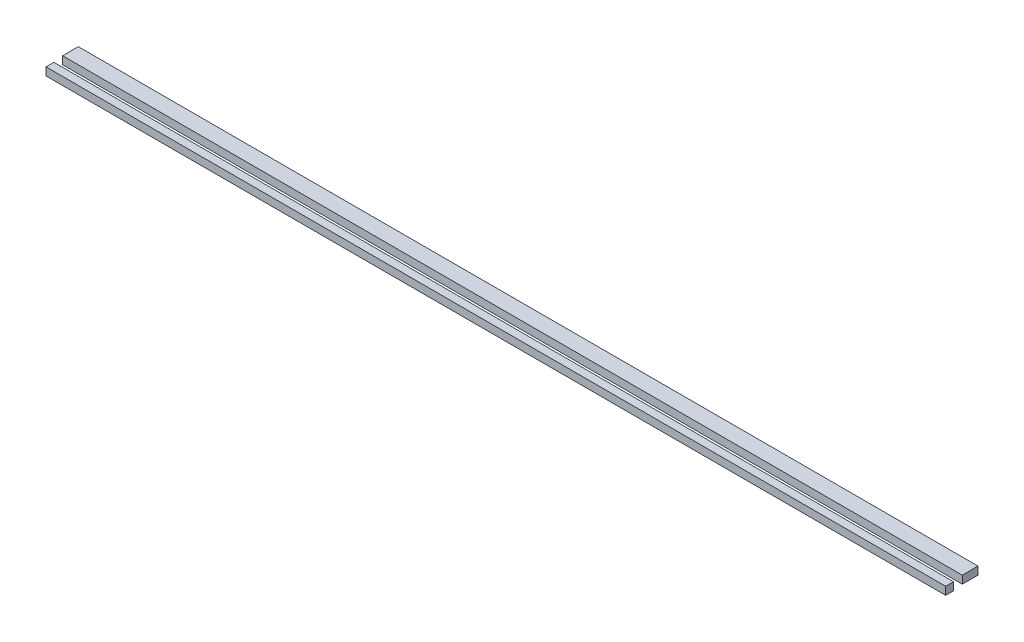
from build123d import *

# Parameters (mm, degrees)
SKETCH1_W           = 343
SKETCH1_H           = 6
BOSS_EXTRUDE1_DEPTH = 3
SKETCH2_W           = 343
SKETCH2_H           = 3
BOSS_EXTRUDE2_DEPTH = 3


with BuildPart() as part:
    # Sketch1 → Boss-Extrude1 (new body)
    with BuildSketch(Plane(origin=(0, 0, 0), x_dir=(1, 0, 0), z_dir=(0, 1, 0))):
        with Locations((0.955964326, 96.802675585)):
            Rectangle(SKETCH1_W, SKETCH1_H)
    extrude(amount=BOSS_EXTRUDE1_DEPTH)


with BuildPart() as body_2:
    # Sketch2 → Boss-Extrude2 (new body)
    with BuildSketch(Plane(origin=(0, 0, 0), x_dir=(1, 0, 0), z_dir=(0, 1, 0))):
        with Locations((39.074390418, 37.5183443)):
            Rectangle(SKETCH2_W, SKETCH2_H)
    extrude(amount=BOSS_EXTRUDE2_DEPTH)


with BuildPart() as body_2_1:
    # Body-Move/Copy1: moved
    add(body_2.part.moved(Location((-37.617381319, 0, -50.953198615))))


solid = Compound([part.part, body_2_1.part])
